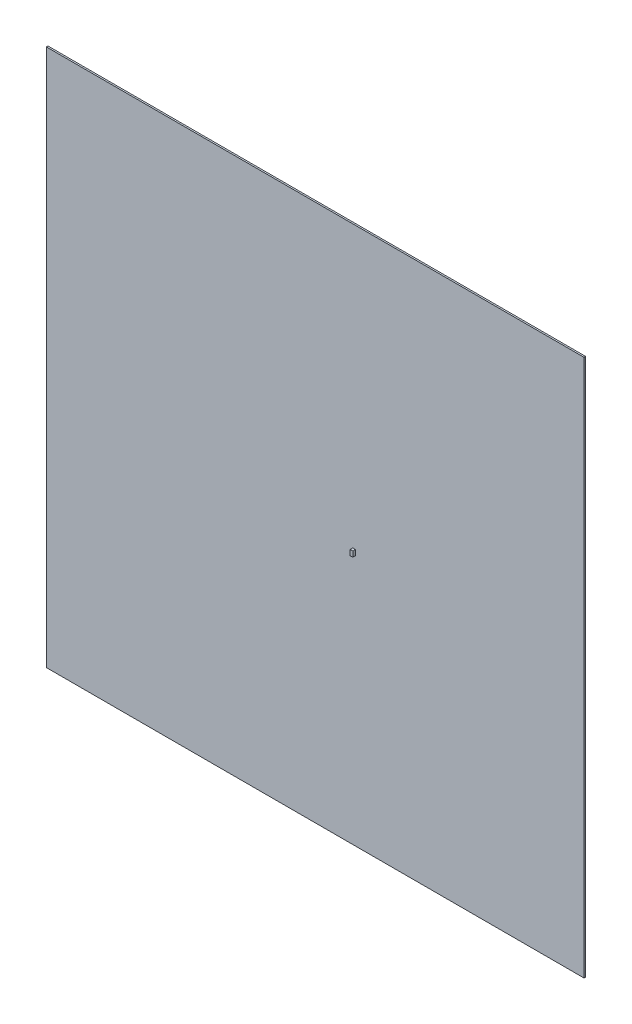
from build123d import *

# Parameters (mm, degrees)
SKETCH_1_W      = 10000
SKETCH_1_H      = 10000
EXTRUDE_1_DEPTH = 30
SKETCH_2_W      = 50
SKETCH_2_H      = 100
EXTRUDE_2_DEPTH = 50


with BuildPart() as part:
    # ｽｹｯﾁ1 → ﾎﾞｽ - 押し出し1 (new body)
    with BuildSketch(Plane.XY):
        with Locations((5000, 5000)):
            Rectangle(SKETCH_1_W, SKETCH_1_H)
    extrude(amount=EXTRUDE_1_DEPTH)

    # ｽｹｯﾁ2 → ﾎﾞｽ - 押し出し2 (add)
    with BuildSketch(Plane.XY.offset(30)):
        with Locations((5724.127488333, 4728.025219222)):
            Rectangle(SKETCH_2_W, SKETCH_2_H)
    extrude(amount=EXTRUDE_2_DEPTH)


solid = part.part
